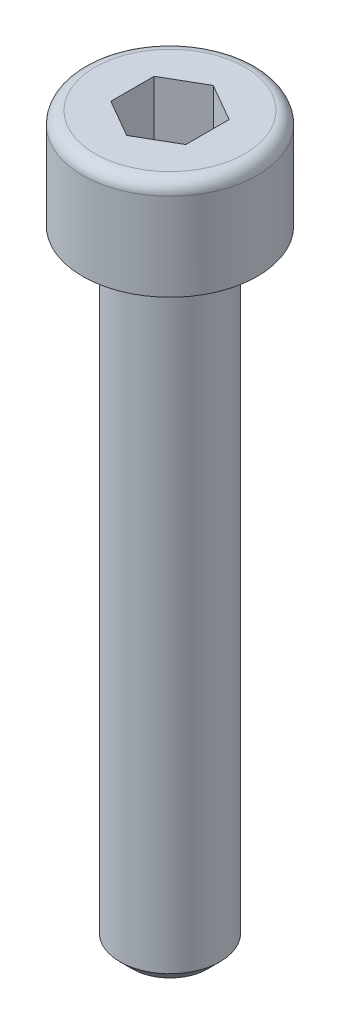
from build123d import *

# Parameters (mm, degrees)
CORTAR_EXTRUIR1_DEPTH = 3
CHAFL_N1_SIZE         = 0.5
REDONDEO1_R           = 0.5


with BuildPart() as part:
    # Croquis1 → Revolución1 (revolve)
    with BuildSketch(Plane.XY, mode=Mode.PRIVATE) as revoluci_n1_sk:
        Polygon((0, 0), (3.5, 0), (3.5, -4), (2, -4), (2, -29), (0, -29), align=None)
    revolve(revoluci_n1_sk.sketch.rotate(Axis((0, 0, 0), (0, -1, 0)), 90), axis=Axis((0, 0, 0), (0, -1, 0)))

    # Croquis2 → Cortar-Extruir1 (cut)
    with BuildSketch(Plane(origin=(0, 0, 0), x_dir=(1, 0, 0), z_dir=(0, 1, 0))):
        Polygon((1.5, 0.866025404), (0, 1.732050808), (-1.5, 0.866025404), (-1.5, -0.866025404), (0, -1.732050808), (1.5, -0.866025404), align=None)
    extrude(amount=-CORTAR_EXTRUIR1_DEPTH, mode=Mode.SUBTRACT)

    # Chaflán1
    chafl_n1_edges = [part.edges().sort_by_distance(p)[0] for p in [
        (0, -29, -2),
    ]]
    chamfer(chafl_n1_edges, length=CHAFL_N1_SIZE)

    # Redondeo1
    redondeo1_edges = [part.edges().sort_by_distance(p)[0] for p in [
        (0, 0, -3.5),
    ]]
    fillet(redondeo1_edges, radius=REDONDEO1_R)


solid = part.part
